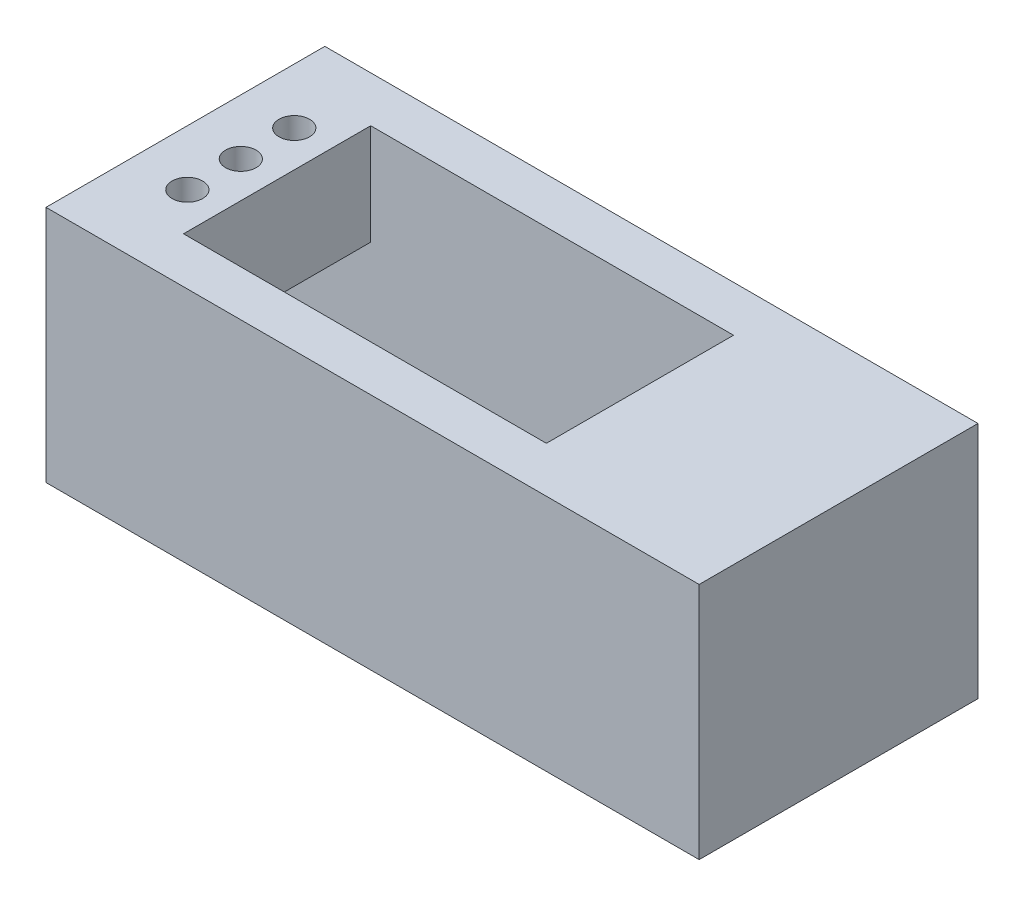
from build123d import *

# Parameters (mm, degrees)
SKETCH1_W           = 23.75
SKETCH1_H           = 12.25
BOSS_EXTRUDE1_DEPTH = 15.6
SKETCH2_W           = 12.25
SKETCH2_H           = 9
CUT_EXTRUDE1_DEPTH  = 10
SKETCH3_R           = 1
CUT_EXTRUDE2_DEPTH  = 3


with BuildPart() as part:
    # Sketch1 → Boss-Extrude1 (new body)
    with BuildSketch(Plane(origin=(0, 0, 0), x_dir=(1, 0, 0), z_dir=(0, 1, 0))):
        Polygon((17.875, -9.125), (24.875, -9.125), (24.875, 9.125), (17.875, 9.125), (-17.875, 9.125), (-17.875, -9.125), align=None)
        Rectangle(SKETCH1_W, SKETCH1_H, mode=Mode.SUBTRACT)
    extrude(amount=BOSS_EXTRUDE1_DEPTH)

    # Sketch2 → Cut-Extrude1 (cut)
    with BuildSketch(Plane.ZY.offset(17.875)):
        with Locations((0, 4.5)):
            Rectangle(SKETCH2_W, SKETCH2_H)
    extrude(amount=-CUT_EXTRUDE1_DEPTH, mode=Mode.SUBTRACT)

    # Sketch3 → Cut-Extrude2 (cut)
    with BuildSketch(Plane(origin=(0, 15.6, 0), x_dir=(1, 0, 0), z_dir=(0, 1, 0))):
        with Locations(Location((-14.245, 3.495, 0), (0, 0, 270))):
            Circle(SKETCH3_R)
        with Locations(Location((-14.245, -0.005, 0), (0, 0, 270))):
            Circle(SKETCH3_R)
        with Locations(Location((-14.245, -3.505, 0), (0, 0, 270))):
            Circle(SKETCH3_R)
    extrude(amount=-CUT_EXTRUDE2_DEPTH, mode=Mode.SUBTRACT)


solid = part.part
